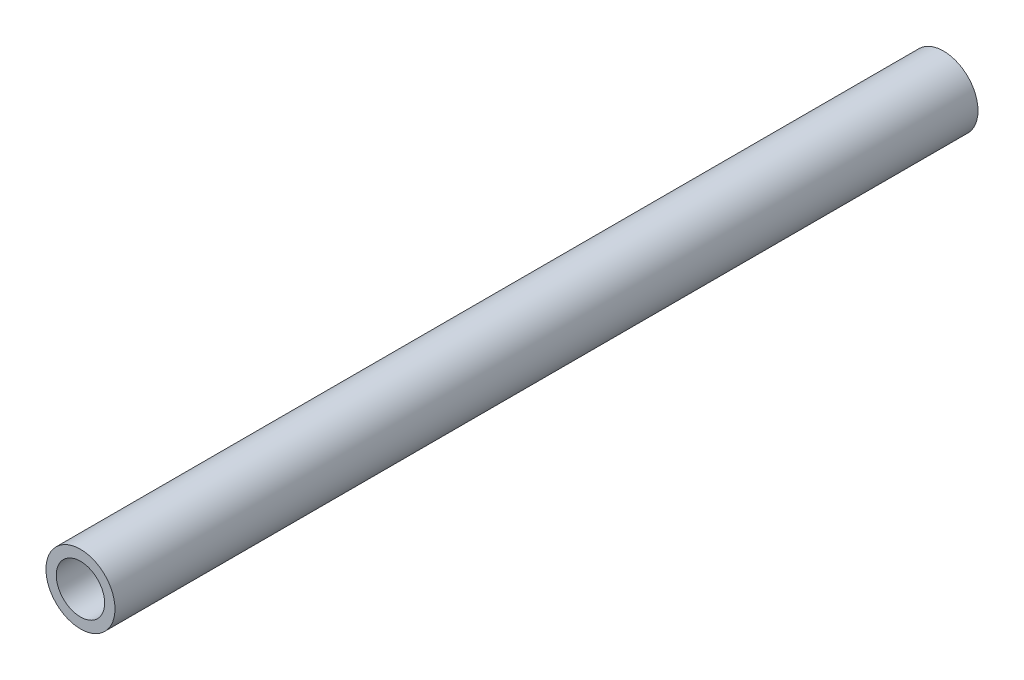
from build123d import *

# Parameters (mm, degrees)
SZKIC1_R                    = 10
SZKIC1_R_2                  = 7
DODANIE_WYCI_GNI_CIE1_DEPTH = 250


with BuildPart() as part:
    # Szkic1 → Dodanie-wyciągnięcie1 (new body)
    with BuildSketch(Plane.XY):
        Circle(SZKIC1_R)
        Circle(SZKIC1_R_2, mode=Mode.SUBTRACT)
    extrude(amount=DODANIE_WYCI_GNI_CIE1_DEPTH)


solid = part.part
